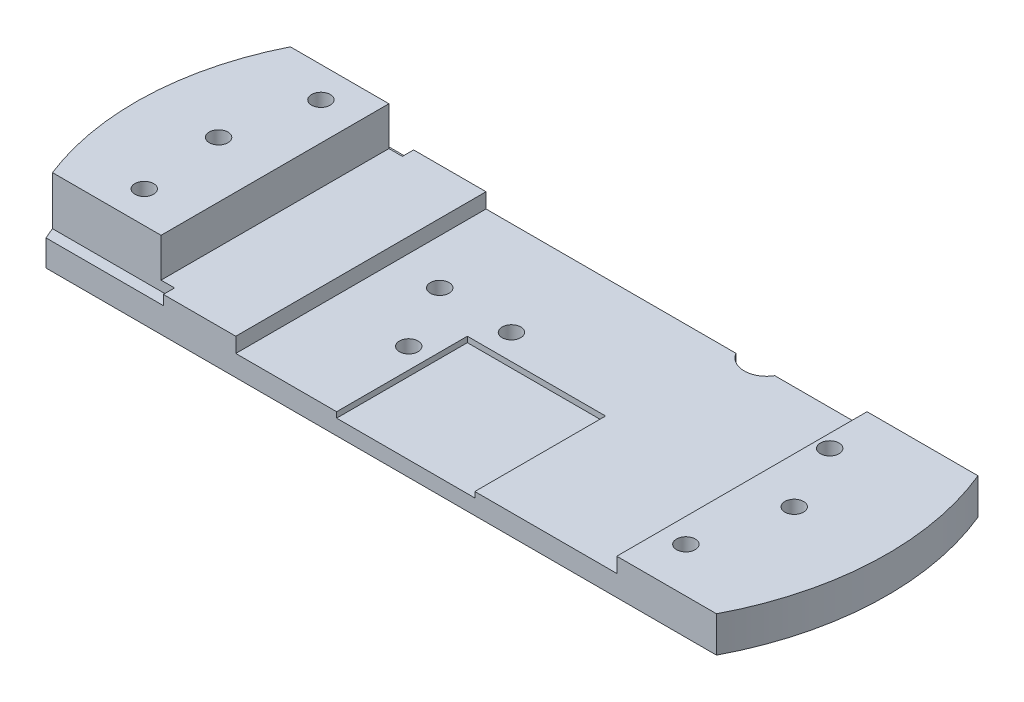
from build123d import *

# Parameters (mm, degrees)
SKETCH1_W           = 195
SKETCH1_H           = 67
BOSS_EXTRUDE1_DEPTH = 20
SKETCH2_R           = 6
CUT_EXTRUDE1_DEPTH  = 20
CUT_EXTRUDE2_DEPTH  = 120.980206701
CUT_EXTRUDE3_START  = -13
SKETCH4_W           = 3.612655346
SKETCH4_H           = 3
CUT_EXTRUDE3_DEPTH  = 13
SKETCH6_R           = 2.5
CUT_EXTRUDE4_DEPTH  = 106.016665344
SKETCH7_W           = 37
SKETCH7_H           = 35
CUT_EXTRUDE5_DEPTH  = 1.5


with BuildPart() as part:
    # Sketch1 → Boss-Extrude1 (new body)
    with BuildSketch(Plane(origin=(0, 0, 0), x_dir=(1, 0, 0), z_dir=(0, 1, 0))):
        Rectangle(SKETCH1_W, SKETCH1_H)
    extrude(amount=BOSS_EXTRUDE1_DEPTH)

    # Sketch2 → Cut-Extrude1 (cut)
    with BuildSketch(Plane.XZ):
        with BuildLine():
            Line((97.5, -3.219751644), (97.5, 33.5))
            Line((97.5, 33.5), (88.5, 33.5))
            ThreePointArc((88.5, 33.5), (95.217186872, 15.683556008), (97.5, -3.219751644))
        make_face()
        with BuildLine():
            Line((97.5, -33.5), (97.5, -3.219751644))
            ThreePointArc((97.5, -3.219751644), (95.985558513, -18.65423771), (91.5, -33.5))
            Line((91.5, -33.5), (97.5, -33.5))
        make_face()
        with BuildLine():
            ThreePointArc((-88, -33.5), (-95.08607052, -15.861694529), (-97.5, 2.992884749))
            Line((-97.5, 2.992884749), (-97.5, -33.5))
            Line((-97.5, -33.5), (-88, -33.5))
        make_face()
        with BuildLine():
            ThreePointArc((-97.5, 2.992884749), (-95.856964648, 18.588830376), (-91, 33.5))
            Line((-91, 33.5), (-97.5, 33.5))
            Line((-97.5, 33.5), (-97.5, 2.992884749))
        make_face()
        with Locations((31.9, -36.5)):
            Circle(SKETCH2_R)
    extrude(amount=-CUT_EXTRUDE1_DEPTH, mode=Mode.SUBTRACT)

    # Sketch3 → Cut-Extrude2 (cut, through all)
    with BuildSketch(Plane(origin=(0, 0, 33.5), x_dir=(-1, 0, 0), z_dir=(0, 0, -1))):
        Polygon((63.2, 20), (63.2, 9.6), (40.2, 9.6), (40.2, 5.6), (-61.8, 5.6), (-61.8, 9.6), (-97.5, 9.6), (-97.5, 20), align=None)
    extrude(amount=CUT_EXTRUDE2_DEPTH, mode=Mode.SUBTRACT)

    # Sketch4 → Cut-Extrude3 (cut)
    with BuildSketch(Plane(origin=(0, 20, 0), x_dir=(1, 0, 0), z_dir=(0, 1, 0)).offset(CUT_EXTRUDE3_START)):
        with BuildLine():
            Line((-63.2, 30.5), (-63.2, 33.5))
            Line((-63.2, 33.5), (-88, 33.5))
            ThreePointArc((-88, 33.5), (-88.810680862, 32.008999469), (-89.587344654, 30.5))
            Line((-89.587344654, 30.5), (-63.2, 30.5))
        make_face()
        with Locations((-61.393672327, 32)):
            Rectangle(SKETCH4_W, SKETCH4_H)
        with BuildLine():
            Line((-63.2, -33.5), (-63.2, -30.5))
            Line((-63.2, -30.5), (-92.261692194, -30.5))
            ThreePointArc((-92.261692194, -30.5), (-91.647155152, -32.006859002), (-91, -33.5))
            Line((-91, -33.5), (-63.2, -33.5))
        make_face()
        with Locations((-61.393672327, -32)):
            Rectangle(SKETCH4_W, SKETCH4_H)
    extrude(amount=CUT_EXTRUDE3_DEPTH, mode=Mode.SUBTRACT)

    # Sketch6 → Cut-Extrude4 (cut, through all)
    with BuildSketch(Plane.XZ):
        with Locations(Location((-28.1, -9, 0), (0, 0, 270))):
            Circle(SKETCH6_R)
        with Locations(Location((-8.2, -8.3, 0), (0, 0, 270))):
            Circle(SKETCH6_R)
        with Locations(Location((-18.7, 8.7, 0), (0, 0, 270))):
            Circle(SKETCH6_R)
        with Locations(Location((-76.2, 22, 0), (0, 0, 270))):
            Circle(SKETCH6_R)
        with Locations(Location((-78.2, 0.1, 0), (0, 0, 270))):
            Circle(SKETCH6_R)
        with Locations(Location((-73.2, -22.3, 0), (0, 0, 270))):
            Circle(SKETCH6_R)
        with Locations(Location((65.3, -20, 0), (0, 0, 270))):
            Circle(SKETCH6_R)
        with Locations(Location((74.1, -1.7, 0), (0, 0, 270))):
            Circle(SKETCH6_R)
        with Locations(Location((68.3, 21.5, 0), (0, 0, 270))):
            Circle(SKETCH6_R)
    extrude(amount=-CUT_EXTRUDE4_DEPTH, mode=Mode.SUBTRACT)

    # Sketch7 → Cut-Extrude5 (cut)
    with BuildSketch(Plane(origin=(0, 5.6, 0), x_dir=(1, 0, 0), z_dir=(0, 1, 0))):
        with Locations((5.3, -16)):
            Rectangle(SKETCH7_W, SKETCH7_H)
    extrude(amount=-CUT_EXTRUDE5_DEPTH, mode=Mode.SUBTRACT)


solid = part.part
